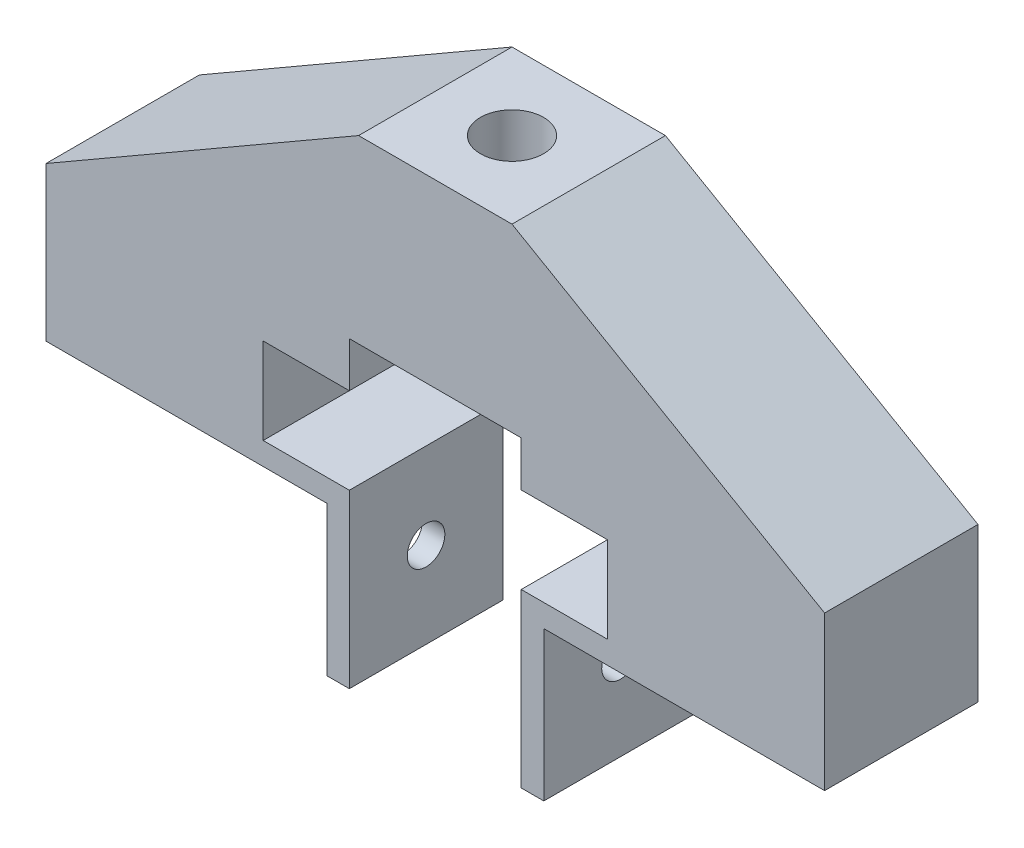
from build123d import *

# Parameters (mm, degrees)
BOSS_EXTRUDE1_DEPTH = 34
SKETCH2_R           = 7
CUT_EXTRUDE1_DEPTH  = 35
SKETCH3_R           = 4.1656
CUT_EXTRUDE2_DEPTH  = 138.185886126


with BuildPart() as part:
    # Sketch1 → Boss-Extrude1 (new body)
    with BuildSketch(Plane.XY):
        Polygon((-86.282032303, 0), (-24.05, 0), (-24.05, -33.1), (-19.05, -33.1), (-19.05, 5), (-38.15, 5), (-38.15, 24.1), (-19.05, 24.1), (-19.05, 34.1), (19.05, 34.1), (19.05, 24.1), (38.15, 24.1), (38.15, 5), (19.05, 5), (19.05, -33.1), (24.05, -33.1), (24.05, 0), (86.282032303, 0), (86.282032303, 34.1), (17, 74.1), (-17, 74.1), (-86.282032303, 34.1), align=None)
    extrude(amount=BOSS_EXTRUDE1_DEPTH)

    # Sketch2 → Cut-Extrude1 (cut)
    with BuildSketch(Plane(origin=(0, 74.1, 0), x_dir=(1, 0, 0), z_dir=(0, 1, 0))):
        with Locations(Location((0, -17, 0), (0, 0, 270))):
            Circle(SKETCH2_R)
    extrude(amount=-CUT_EXTRUDE1_DEPTH, mode=Mode.SUBTRACT)

    # Sketch3 → Cut-Extrude2 (cut, through all)
    with BuildSketch(Plane(origin=(24.05, 0, 0), x_dir=(0, 0, -1), z_dir=(1, 0, 0))):
        with Locations(Location((-17, -14.05, 0), (0, 0, 90))):
            Circle(SKETCH3_R)
    extrude(amount=-CUT_EXTRUDE2_DEPTH, mode=Mode.SUBTRACT)


solid = part.part
